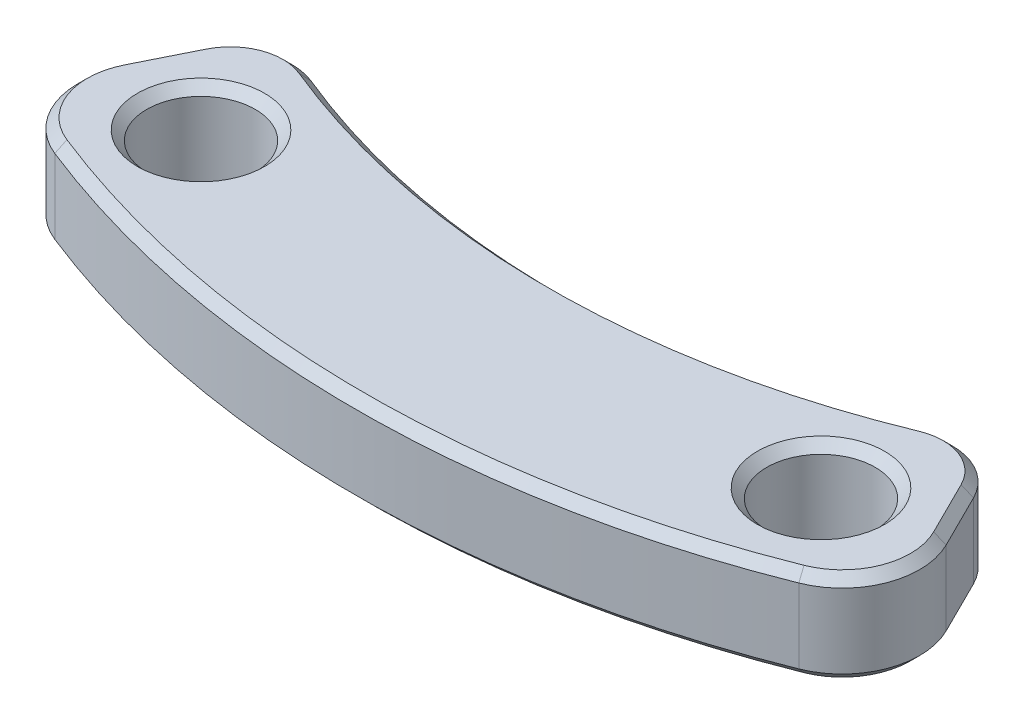
from build123d import *

# Parameters (mm, degrees)
SKETCH_1_R      = 1.75
EXTRUDE_1_DEPTH = 3
CHAMFER_1_SIZE  = 0.3


with BuildPart() as part:
    # 草图1 → 凸台-拉伸1 (new body)
    with BuildSketch(Plane(origin=(0, 0, 0), x_dir=(1, 0, 0), z_dir=(0, 1, 0))):
        with BuildLine():
            Line((-8.058099854, 3.286572102), (-8.934273675, 1.52529864))
            ThreePointArc((-8.934273675, 1.52529864), (-9.030809196, -0.481724252), (-7.6190352, -1.911533393))
            ThreePointArc((-7.6190352, -1.911533393), (4.381181498, -4.208142868), (16.381398197, -1.911533393))
            ThreePointArc((16.381398197, -1.911533393), (17.793172193, -0.481724252), (17.696636672, 1.52529864))
            Line((17.696636672, 1.52529864), (16.820462851, 3.286572102))
            ThreePointArc((16.820462851, 3.286572102), (15.733455475, 4.267905138), (14.26918179, 4.245496696))
            ThreePointArc((14.26918179, 4.245496696), (4.381181498, 2.291857132), (-5.506818793, 4.245496696))
            ThreePointArc((-5.506818793, 4.245496696), (-6.971092478, 4.267905138), (-8.058099854, 3.286572102))
        make_face()
        with Locations(Location((-5.618818502, 0.804359974, 0), (0, 0, 270))):
            Circle(SKETCH_1_R, mode=Mode.SUBTRACT)
        with Locations(Location((14.381181498, 0.804359974, 0), (0, 0, 270))):
            Circle(SKETCH_1_R, mode=Mode.SUBTRACT)
    extrude(amount=EXTRUDE_1_DEPTH)

    # 倒角1
    chamfer_1_edges = [part.edges().sort_by_distance(p)[0] for p in [
        (4.381181498, 0, -2.291857132),
        (15.733455475, 0, -4.267905138),
        (17.258549762, 0, -2.405935371),
        (17.793172193, 0, 0.481724252),
        (15.733455475, 3, -4.267905138),
        (4.381181498, 3, -2.291857132),
        (-6.971092478, 3, -4.267905138),
        (-5.618818502, 0, -2.554359974),
        (-5.618818502, 3, -2.554359974),
        (-8.496186765, 3, -2.405935371),
        (14.381181498, 0, -2.554359974),
        (14.381181498, 3, -2.554359974),
        (-9.030809196, 3, 0.481724252),
        (4.381181498, 3, 4.208142868),
        (17.793172193, 3, 0.481724252),
        (4.381181498, 0, 4.208142868),
        (17.258549762, 3, -2.405935371),
        (-9.030809196, 0, 0.481724252),
        (-8.496186765, 0, -2.405935371),
        (-6.971092478, 0, -4.267905138),
    ]]
    chamfer(chamfer_1_edges, length=CHAMFER_1_SIZE)


solid = part.part
